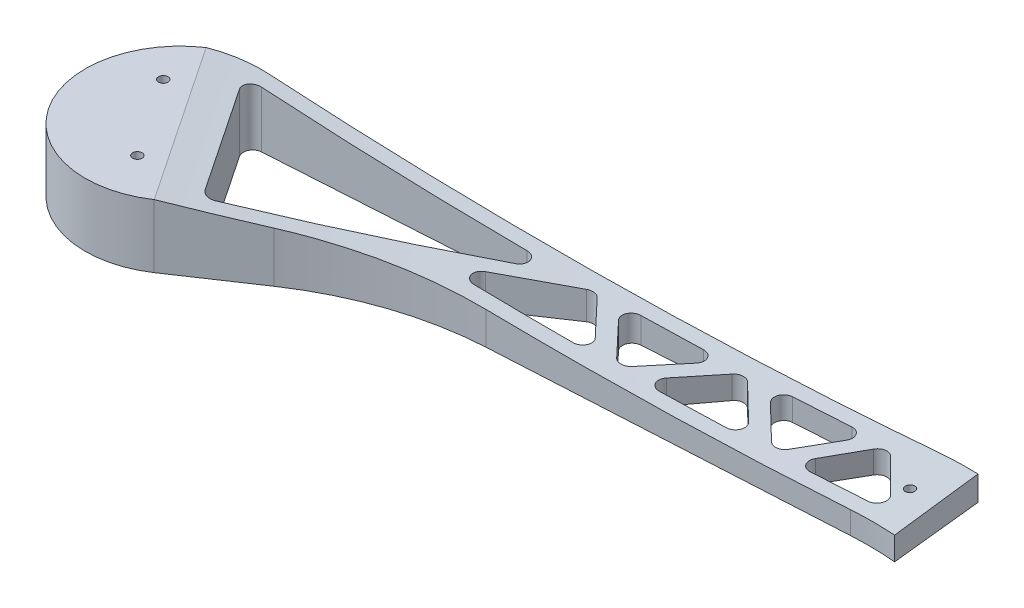
from build123d import *

# Parameters (mm, degrees)
SKETCH1_R               = 5
SKETCH1_R_2             = 2
BOSS_EXTRUDE1_DEPTH     = 20
FILLET1_R               = 100
CUT_EXTRUDE3_DEPTH      = 300
CUT_EXTRUDE3_DEPTH_BACK = 131
FILLET3_R               = 5
SKETCH4_R               = 1.5
CUT_EXTRUDE4_DEPTH      = 114
FILLET4_R               = 3
CUT_EXTRUDE5_DEPTH      = 83


with BuildPart() as part:
    # Sketch1 → Boss-Extrude1 (new body)
    with BuildSketch(Plane(origin=(0, 0, 0), x_dir=(1, 0, 0), z_dir=(0, 1, 0))):
        with BuildLine():
            Line((0, 15), (-139.784941349, 43.225909045))
            Line((-139.784941349, 43.225909045), (-351.875415017, 29.941322925))
            ThreePointArc((-351.875415017, 29.941322925), (-378.412739548, -9.628926804), (-333.285739517, -24.912516864))
            Line((-333.285739517, -24.912516864), (-287.823465989, 5.588948968))
            Line((-287.823465989, 5.588948968), (-138.053278996, 13.889014505))
            Line((-138.053278996, 13.889014505), (-5.919683, -13.782501703))
            Line((-5.919683, -13.782501703), (0, -15))
            Line((0, -15), (40, -15))
            ThreePointArc((40, -15), (55, 0), (40, 15))
            Line((40, 15), (0, 15))
        make_face()
        with Locations(Location((0, 0, 0), (0, 0, 270))):
            Circle(SKETCH1_R, mode=Mode.SUBTRACT)
        with Locations(Location((40, 0, 0), (0, 0, 270))):
            Circle(SKETCH1_R_2, mode=Mode.SUBTRACT)
    extrude(amount=BOSS_EXTRUDE1_DEPTH)

    # Fillet1
    fillet1_edges = [part.edges().sort_by_distance(p)[0] for p in [
        (0, 10, -15),
        (-139.784941349, 10, -43.225909045),
        (-138.053278996, 10, -13.889014505),
        (-287.823465989, 10, -5.588948968),
        (0, 10, 15),
    ]]
    fillet(fillet1_edges, radius=FILLET1_R)

    # Sketch3 → Cut-Extrude3 (cut, two sides: drawn at the far end of the back side and taken through both)
    with BuildSketch(Plane(origin=(-86.356848498, 0, -128.714426022), x_dir=(0.8304172287941746, 0, -0.557142016116002), z_dir=(0.557142016116002, 0, 0.8304172287941746)).offset(-CUT_EXTRUDE3_DEPTH_BACK)):
        with BuildLine():
            Line((0.156842574, 20), (-290.646030078, 20))
            add(Edge.make_bspline(
                [(-290.646030078, 20), (-152.53466, -2.539392014), (-15.681609056, 14)],
                knots=[0, 0, 0, 1, 1, 1], degree=2))
            add(Edge.make_bspline(
                [(-15.681609056, 14), (1.778655923, 1.080988316), (32.031463633, 10), (48.216689152, 10)],
                knots=[0, 0, 0, 0, 1, 1, 1, 1], degree=3))
            Line((48.216689152, 10), (48.216689152, 20))
            Line((48.216689152, 20), (0.156842574, 20))
        make_face()
        with BuildLine():
            Line((0.156842574, 20), (-290.646030078, 20))
            add(Edge.make_bspline(
                [(-290.646030078, 20), (-152.53466, -2.539392014), (-15.681609056, 14)],
                knots=[0, 0, 0, 1, 1, 1], degree=2))
            add(Edge.make_bspline(
                [(-15.681609056, 14), (1.778655923, 1.080988316), (32.031463633, 10), (48.216689152, 10)],
                knots=[0, 0, 0, 0, 1, 1, 1, 1], degree=3))
            Line((48.216689152, 10), (48.216689152, 20))
            Line((48.216689152, 20), (0.156842574, 20))
        make_face()
    extrude(amount=CUT_EXTRUDE3_DEPTH + CUT_EXTRUDE3_DEPTH_BACK, mode=Mode.SUBTRACT)

    # Fillet3
    fillet3_edges = [part.edges().sort_by_distance(p)[0] for p in [
        (-21.864392185, 14, -4.442240649),
    ]]
    fillet(fillet3_edges, radius=FILLET3_R)

    # Sketch4 → Cut-Extrude4 (cut)
    with BuildSketch(Plane(origin=(0, 0, 0), x_dir=(1, 0, 0), z_dir=(0, 1, 0))):
        with Locations(Location((-147.336246923, 28.050603479, 0), (0, 0, 90))):
            Circle(SKETCH4_R)
        with Locations(Location((-130.791911053, 26.905656844, 0), (0, 0, 90))):
            Circle(SKETCH4_R)
        with Locations(Location((-364.746711272, 9.415773639, 0), (0, 0, 270))):
            Circle(SKETCH4_R)
        with Locations(Location((-348.032450789, -15.496743225, 0), (0, 0, 270))):
            Circle(SKETCH4_R)
        Polygon((-23.866128519, -4.915677567), (-39.103088127, 17.794930154), (-75.639684705, 5.926779178), align=None)
        Polygon((-49.0834237, 19.810197617), (-105.838380632, 31.270375206), (-85.479969978, 7.987539058), align=None)
        Polygon((-113.9043748, 32.899091544), (-93.610691693, 9.690280862), (-134.183540545, 18.187077125), align=None)
        Polygon((-143.989822428, 18.567691314), (-162.24368626, 36.809375165), (-173.639207374, 16.924561642), align=None)
        Polygon((-168.221096355, 36.434971648), (-179.591082035, 16.594716626), (-198.135268167, 34.561255282), align=None)
        Polygon((-186.387937739, 16.218043878), (-204.884563485, 34.138503645), (-219.662547376, 14.374009052), align=None)
        Polygon((-211.434434242, 33.728243247), (-226.175542257, 14.013067496), (-242.935285915, 31.755142949), align=None)
        Polygon((-232.71148459, 13.650854223), (-279.687517615, 11.047504647), (-249.429154901, 31.348390301), align=None)
        Polygon((-259.327642719, 30.728384548), (-327.767277309, -15.189010559), (-354.571570516, 24.762646722), align=None)
    extrude(amount=CUT_EXTRUDE4_DEPTH, mode=Mode.SUBTRACT)

    # Fillet4
    fillet4_edges = [part.edges().sort_by_distance(p)[0] for p in [
        (-23.866128519, 6.59687861, 4.915677567),
        (-75.639684705, 4.853769064, -5.926779178),
        (-39.103088127, 6.59687861, -17.794930154),
        (-49.0834237, 6.203132148, -19.810197617),
        (-85.479969978, 4.603063185, -7.987539058),
        (-105.838380632, 4.473862314, -31.270375206),
        (-93.610691693, 4.415303992, -9.690280862),
        (-134.183540545, 3.740248049, -18.187077125),
        (-113.9043748, 4.298352255, -32.899091544),
        (-143.989822428, 3.631366763, -18.567691314),
        (-173.639207374, 3.502352989, -16.924561642),
        (-162.24368626, 3.579543024, -36.809375165),
        (-179.591082035, 3.517150778, -16.594716626),
        (-198.135268167, 3.547363849, -34.561255282),
        (-168.221096355, 3.539514704, -36.434971648),
        (-204.884563485, 3.597054187, -34.138503645),
        (-186.387937739, 3.550671331, -16.218043878),
        (-219.662547376, 3.97020999, -14.374009052),
        (-242.935285915, 4.206596653, -31.755142949),
        (-226.175542257, 4.101905497, -14.013067496),
        (-211.434434242, 3.662123803, -33.728243247),
        (-279.687517615, 5.796823139, -11.047504647),
        (-232.71148459, 4.250360261, -13.650854223),
        (-249.429154901, 4.366437166, -31.348390301),
        (-259.327642719, 4.641338109, -30.728384548),
        (-354.571570516, 9.209496695, -24.762646722),
        (-327.767277309, 9.209496695, 15.189010559),
    ]]
    fillet(fillet4_edges, radius=FILLET4_R)

    # Sketch5 → Cut-Extrude5 (cut)
    with BuildSketch(Plane(origin=(0, 0, 0), x_dir=(1, 0, 0), z_dir=(0, 1, 0))):
        Polygon((-149.224964635, 128.266447682), (-126.011497046, -92.59494321), (104.726225705, -43.123683348), (52.275964972, 176.408673493), align=None)
    extrude(amount=CUT_EXTRUDE5_DEPTH, mode=Mode.SUBTRACT)


solid = part.part
